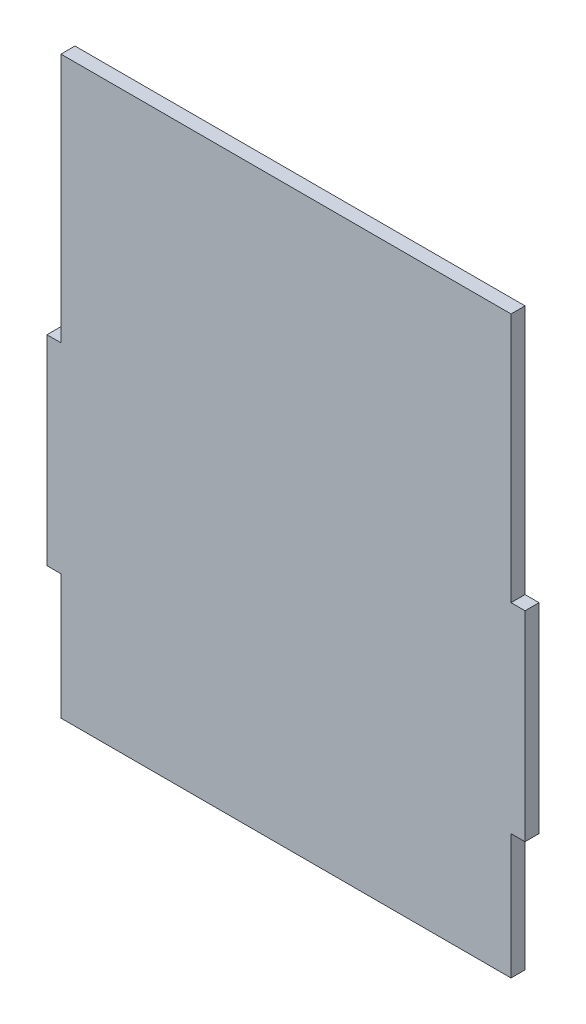
from build123d import *

# Parameters (mm, degrees)
EXTRUDE_1_DEPTH = 1.4


with BuildPart() as part:
    # Эскиз1 → Бобышка-Вытянуть1 (new, symmetric)
    with BuildSketch(Plane.XY):
        Polygon((-45, 7.5), (-45, 57.5), (45, 57.5), (45, 7.5), (47.8, 7.5), (47.8, -32.5), (45, -32.5), (45, -57.5), (-45, -57.5), (-45, -32.5), (-47.8, -32.5), (-47.8, 7.5), align=None)
    extrude(amount=EXTRUDE_1_DEPTH, both=True)


solid = part.part
